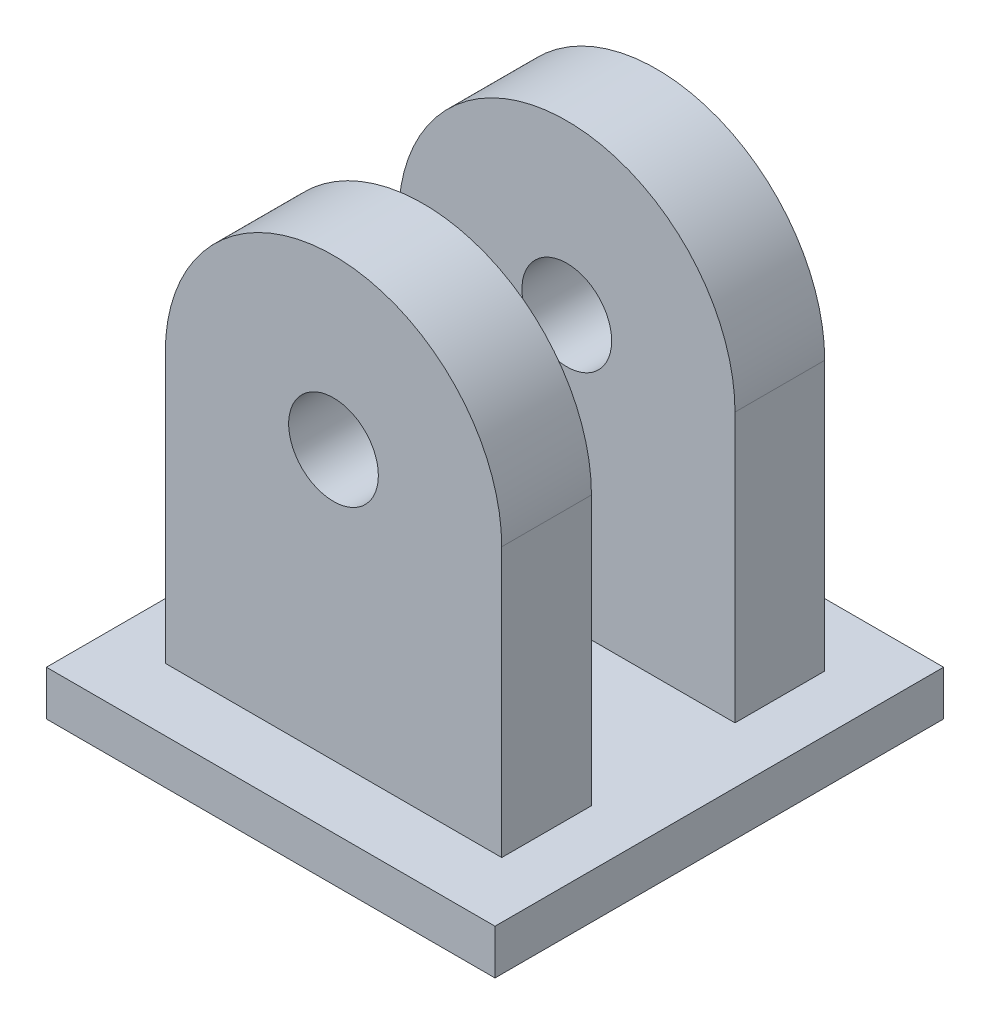
from build123d import *

# Parameters (mm, degrees)
CROQUIS1_R              = 1
SALIENTE_EXTRUIR1_DEPTH = 2
MATRIZL1_COUNT          = 2
MATRIZL1_PITCH          = 5.2
CROQUIS2_W              = 10
CROQUIS2_H              = 10
SALIENTE_EXTRUIR2_DEPTH = 1


with BuildPart() as part:
    # Croquis1 → Saliente-Extruir1 (new body)
    with BuildSketch(Plane.XY):
        with BuildLine():
            Line((-3.75, 0), (-3.75, -6))
            Line((-3.75, -6), (3.75, -6))
            Line((3.75, -6), (3.75, 0))
            ThreePointArc((3.75, 0), (0, 3.75), (-3.75, 0))
        make_face()
        Circle(CROQUIS1_R, mode=Mode.SUBTRACT)
    extrude(amount=SALIENTE_EXTRUIR1_DEPTH)


with BuildPart() as matrizl1_1:
    # MatrizL1: pattern copy
    add(part.part.moved(Location(Vector(0, 0, 1) * (1 * MATRIZL1_PITCH))))


with BuildPart() as part_1:
    add(part.part)

    add(matrizl1_1.part)  # Saliente-Extruir2 merges MatrizL1_1
    # Croquis2 → Saliente-Extruir2 (add)
    with BuildSketch(Plane.XZ.offset(6)):
        with Locations((0, 3.6)):
            Rectangle(CROQUIS2_W, CROQUIS2_H)
    extrude(amount=SALIENTE_EXTRUIR2_DEPTH)


solid = part_1.part
